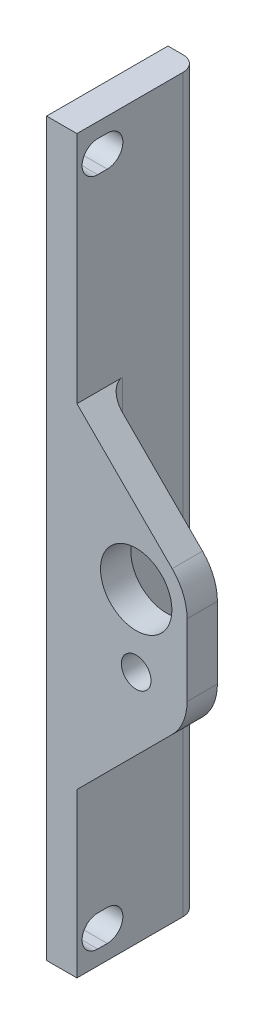
from build123d import *

# Parameters (mm, degrees)
BOSS_EXTRUDE1_DEPTH = 6.35
SKETCH2_R           = 7.475
SKETCH2_R_2         = 3.0999938
BOSS_EXTRUDE2_DEPTH = 6.35
FILLET1_R           = 3.175


with BuildPart() as part:
    # Sketch1 → Boss-Extrude1 (new body)
    with BuildSketch(Plane(origin=(0, 0, 0), x_dir=(0, 0, -1), z_dir=(1, 0, 0))):
        Polygon((-4.34721, -76.524739), (4.34721, -76.524739), (21.05279, -76.524739), (21.05279, 76.524739), (4.34721, 76.524739), (-4.34721, 76.524739), align=None)
        with BuildLine():
            Line((0, 73.438639), (2, 73.438639))
            ThreePointArc((2, 73.438639), (5.2639, 70.174739), (2, 66.910839))
            Line((2, 66.910839), (0, 66.910839))
            ThreePointArc((0, 66.910839), (-3.2639, 70.174739), (0, 73.438639))
        make_face(mode=Mode.SUBTRACT)
        with BuildLine():
            Line((0, -66.910839), (2, -66.910839))
            ThreePointArc((2, -66.910839), (5.2639, -70.174739), (2, -73.438639))
            Line((2, -73.438639), (0, -73.438639))
            ThreePointArc((0, -73.438639), (-3.2639, -70.174739), (0, -66.910839))
        make_face(mode=Mode.SUBTRACT)
    extrude(amount=BOSS_EXTRUDE1_DEPTH)

    # Sketch2 → Boss-Extrude2 (add)
    with BuildSketch(Plane.XY.offset(4.34721)):
        with BuildLine():
            Line((6.35, 27.567699439), (26.28122122, 7.63647822))
            ThreePointArc((26.28122122, 7.63647822), (28.589851021, 4.181369555), (29.400534, 0.105791))
            Line((29.400534, 0.105791), (29.400534, -14.894209))
            ThreePointArc((29.400534, -14.894209), (28.589851021, -18.969787555), (26.28122122, -22.42489622))
            Line((26.28122122, -22.42489622), (6.35, -42.356117439))
            Line((6.35, -42.356117439), (6.35, 27.567699439))
        make_face()
        with Locations((18.750534, 0.105791)):
            Circle(SKETCH2_R, mode=Mode.SUBTRACT)
        with Locations((18.750534, -14.894209)):
            Circle(SKETCH2_R_2, mode=Mode.SUBTRACT)
    extrude(amount=-BOSS_EXTRUDE2_DEPTH)

    # Fillet1
    fillet1_edges = [part.edges().sort_by_distance(p)[0] for p in [
        (6.35, 0, -21.05279),
        (6.35, -7.394209, -2.00279),
    ]]
    fillet(fillet1_edges, radius=FILLET1_R)


solid = part.part
